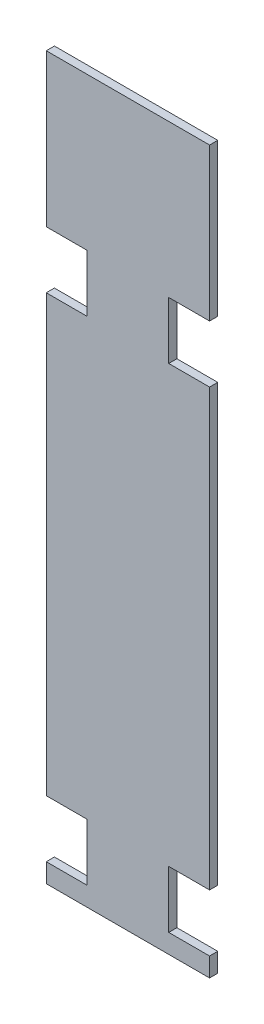
from build123d import *

# Parameters (mm, degrees)
EXTRUDE_1_DEPTH     = 3
SKETCH_4_W          = 15
SKETCH_4_H          = 21
CUT_EXTRUDE_1_DEPTH = 3


with BuildPart() as part:
    # 草图1 → 凸台-拉伸1 (new body)
    with BuildSketch(Plane.XY):
        Polygon((0, 240), (0, 265), (60, 265), (60, 240), (60, 0), (0, 0), align=None)
    extrude(amount=EXTRUDE_1_DEPTH)

    # 草图4 → 切除-拉伸1 (cut)
    with BuildSketch(Plane(origin=(0, 0, 0), x_dir=(-1, 0, 0), z_dir=(0, 0, -1))):
        with Locations((-52.5, 17.5)):
            Rectangle(SKETCH_4_W, SKETCH_4_H)
        with Locations((-7.5, 17.5)):
            Rectangle(SKETCH_4_W, SKETCH_4_H)
        with Locations((-7.5, 198.5)):
            Rectangle(SKETCH_4_W, SKETCH_4_H)
        with Locations((-52.5, 198.5)):
            Rectangle(SKETCH_4_W, SKETCH_4_H)
    extrude(amount=-CUT_EXTRUDE_1_DEPTH, mode=Mode.SUBTRACT)


solid = part.part
